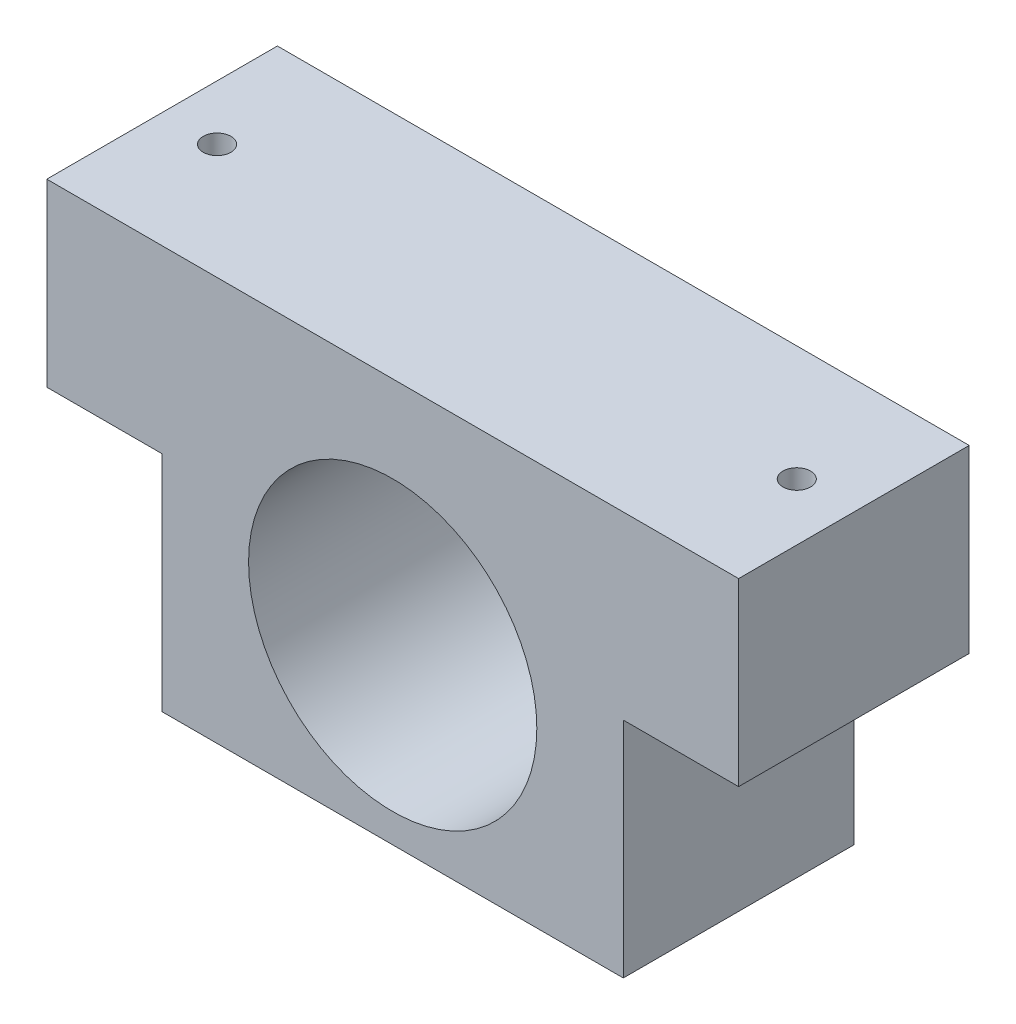
from build123d import *

# Parameters (mm, degrees)
SKETCH_1_R                   = 12.5
EXTRUDE_1_DEPTH              = 20
HOLE_WIZARD_M2_1_D           = 2.4
HOLE_WIZARD_M2_1_CBORE_D     = 6
HOLE_WIZARD_M2_1_CBORE_DEPTH = 0.5


with BuildPart() as part:
    # 草图1 → 凸台-拉伸1 (new body)
    with BuildSketch(Plane.XY):
        Polygon((-340.66541114, -145.626712598), (-330.66541114, -145.626712598), (-330.66541114, -165), (-290.66541114, -165), (-290.66541114, -145.626712598), (-280.66541114, -145.626712598), (-280.66541114, -130), (-340.66541114, -130), align=None)
        with Locations((-310.66541114, -150)):
            Circle(SKETCH_1_R, mode=Mode.SUBTRACT)
    extrude(amount=EXTRUDE_1_DEPTH)

    # M2 六角头螺栓的柱形沉头孔1 (through all)
    with Locations(Plane(origin=(0, -145.626712598, 0), x_dir=(-1, 0, 0), z_dir=(0, -1, 0))):
        with Locations((335.897321014, -10), (285.620390856, -10)):
            CounterBoreHole(HOLE_WIZARD_M2_1_D / 2, HOLE_WIZARD_M2_1_CBORE_D / 2, HOLE_WIZARD_M2_1_CBORE_DEPTH)


solid = part.part
